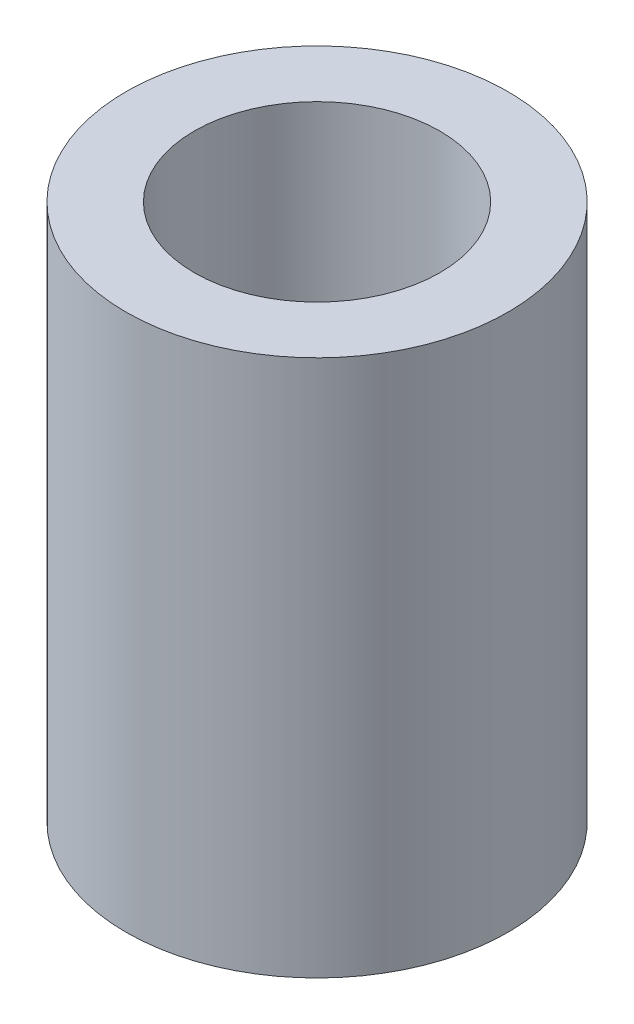
from build123d import *

# Parameters (mm, degrees)
SKETCH1_R           = 3.556
BOSS_EXTRUDE1_DEPTH = 10
SKETCH2_R           = 2.286
CUT_EXTRUDE1_DEPTH  = 7.5


with BuildPart() as part:
    # Sketch1 → Boss-Extrude1 (new body)
    with BuildSketch(Plane(origin=(0, 0, 0), x_dir=(1, 0, 0), z_dir=(0, 1, 0))):
        with Locations(Location((0, 0, 0), (0, 0, 270))):
            Circle(SKETCH1_R)
    extrude(amount=BOSS_EXTRUDE1_DEPTH)

    # Sketch2 → Cut-Extrude1 (cut)
    with BuildSketch(Plane(origin=(0, 10, 0), x_dir=(1, 0, 0), z_dir=(0, 1, 0))):
        with Locations(Location((0, 0, 0), (0, 0, 270))):
            Circle(SKETCH2_R)
    extrude(amount=-CUT_EXTRUDE1_DEPTH, mode=Mode.SUBTRACT)


solid = part.part
